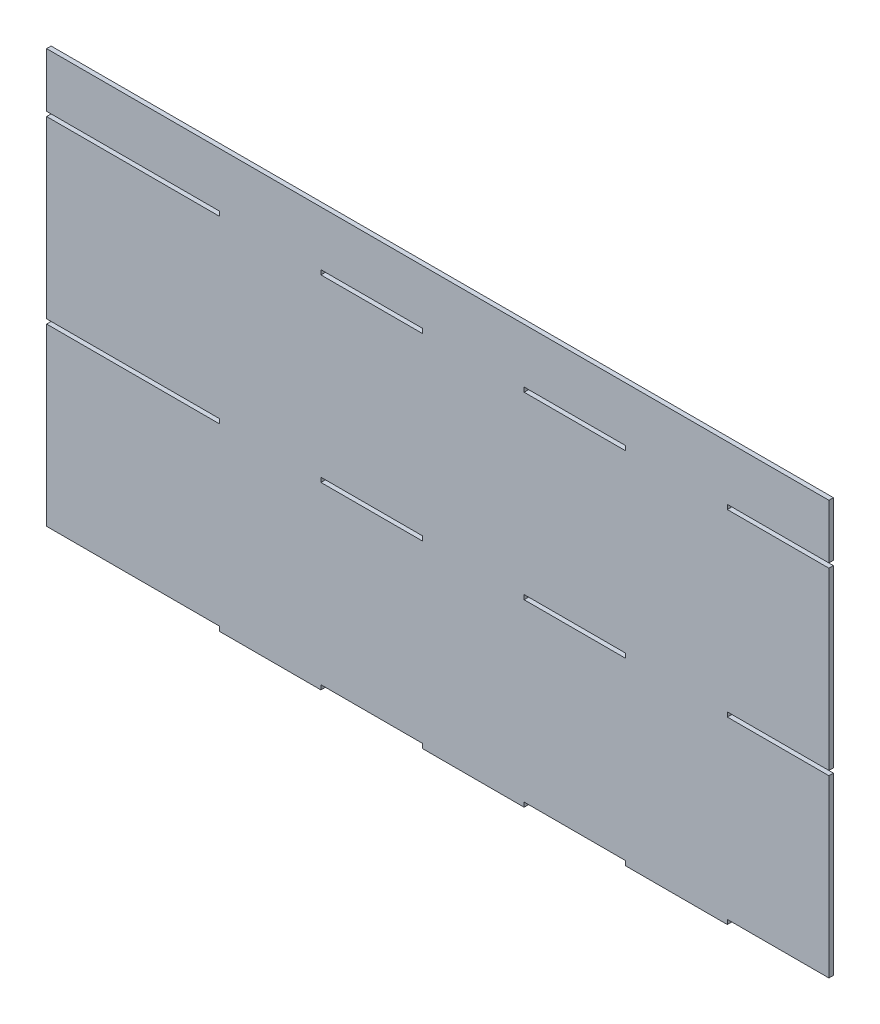
from build123d import *

# Parameters (mm, degrees)
SKETCH1_W           = 71.428571428
SKETCH1_H           = 3.175
SKETCH1_W_2         = 71.428571429
BOSS_EXTRUDE1_DEPTH = 3.175


with BuildPart() as part:
    # Sketch1 → Boss-Extrude1 (new body)
    with BuildSketch(Plane.XY):
        Polygon((50.899754495, -0.012509515), (122.328325923, -0.012509515), (122.328325923, 3.162490485), (193.756897352, 3.162490485), (193.756897352, -0.012509515), (265.185468781, -0.012509515), (265.185468781, 3.162490485), (336.614040209, 3.162490485), (336.614040209, -0.012509515), (408.042611638, -0.012509515), (408.042611638, 3.162490485), (479.471183066, 3.162490485), (479.471183066, 126.337490485), (408.042611638, 126.337490485), (408.042611638, 129.512490485), (479.471183066, 129.512490485), (479.471183066, 252.687490485), (408.042611638, 252.687490485), (408.042611638, 255.862490485), (479.471183066, 255.862490485), (479.471183066, 294.037490485), (166.471183066, 294.037490485), (-20.528816934, 294.037490485), (-70.528816934, 294.037490485), (-70.528816934, 255.862490485), (50.899754495, 255.862490485), (50.899754495, 252.687490485), (-70.528816934, 252.687490485), (-70.528816934, 129.512490485), (50.899754495, 129.512490485), (50.899754495, 126.337490485), (-70.528816934, 126.337490485), (-70.528816934, 3.162490485), (50.899754495, 3.162490485), align=None)
        with Locations((300.899754495, 127.924990485)):
            Rectangle(SKETCH1_W, SKETCH1_H, mode=Mode.SUBTRACT)
        with Locations((300.899754495, 254.274990485)):
            Rectangle(SKETCH1_W, SKETCH1_H, mode=Mode.SUBTRACT)
        with Locations((158.042611638, 127.924990485)):
            Rectangle(SKETCH1_W_2, SKETCH1_H, mode=Mode.SUBTRACT)
        with Locations((158.042611638, 254.274990485)):
            Rectangle(SKETCH1_W_2, SKETCH1_H, mode=Mode.SUBTRACT)
    extrude(amount=BOSS_EXTRUDE1_DEPTH)


solid = part.part
